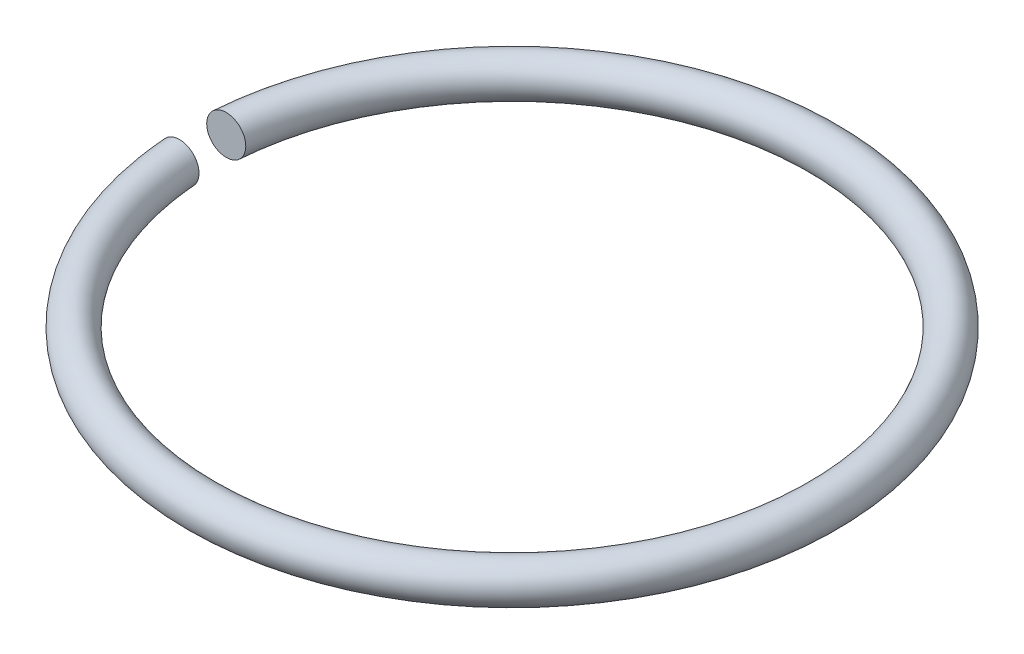
from build123d import *

# Parameters (mm, degrees)
SKETCH_1_R          = 1.25
SKETCH_2_W          = 8.762505604
SKETCH_2_H          = 3
CUT_EXTRUDE_1_DEPTH = 31.014913109


with BuildPart() as part:
    # Эскиз1 → Повернуть1 (revolve)
    with BuildSketch(Plane.XY, mode=Mode.PRIVATE) as revolve_1_sk:
        with Locations((-19.9, 1.25)):
            Circle(SKETCH_1_R)
    revolve(revolve_1_sk.sketch.rotate(Axis((0, 0, 0), (0, 1, 0)), 270), axis=Axis((0, 0, 0), (0, 1, 0)))

    # Эскиз2 → Вырез-Вытянуть1 (cut, through all)
    with BuildSketch(Plane(origin=(0, 0, 0), x_dir=(1, 0, 0), z_dir=(0, 1, 0))):
        with Locations((-20.458545692, 0)):
            Rectangle(SKETCH_2_W, SKETCH_2_H)
    extrude(amount=CUT_EXTRUDE_1_DEPTH, mode=Mode.SUBTRACT)


solid = part.part
